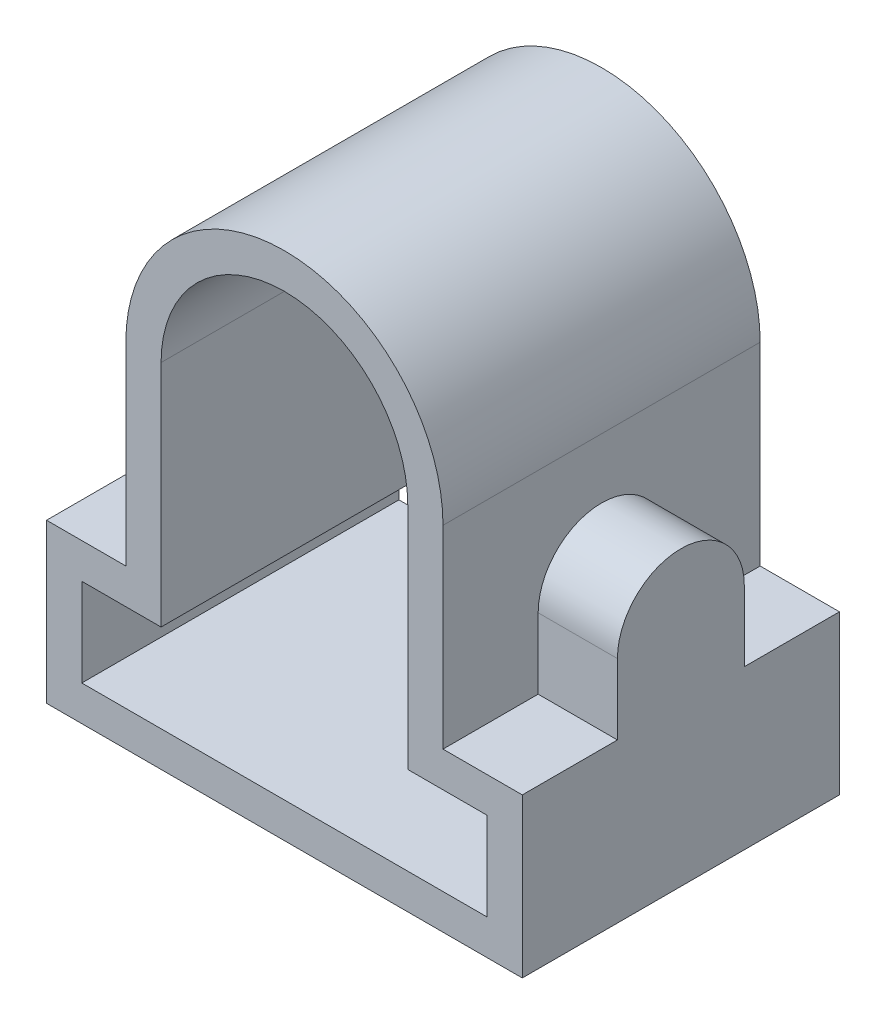
from build123d import *

# Parameters (mm, degrees)
BOSS_EXTRUDE1_DEPTH = 45
BOSS_EXTRUDE2_DEPTH = 22.5


with BuildPart() as part:
    # Sketch1 → Boss-Extrude1 (new, symmetric)
    with BuildSketch(Plane.XY):
        with BuildLine():
            Line((-67.5, 0), (67.5, 0))
            Line((67.5, 0), (67.5, 45))
            Line((67.5, 45), (45, 45))
            Line((45, 45), (45, 100))
            ThreePointArc((45, 100), (0, 145), (-45, 100))
            Line((-45, 100), (-45, 45))
            Line((-45, 45), (-67.5, 45))
            Line((-67.5, 45), (-67.5, 0))
        make_face()
        with BuildLine():
            Line((-35, 35), (-35, 100))
            ThreePointArc((-35, 100), (0, 135), (35, 100))
            Line((35, 100), (35, 35))
            Line((35, 35), (57.5, 35))
            Line((57.5, 35), (57.5, 10))
            Line((57.5, 10), (-57.5, 10))
            Line((-57.5, 10), (-57.5, 35))
            Line((-57.5, 35), (-35, 35))
        make_face(mode=Mode.SUBTRACT)
    extrude(amount=BOSS_EXTRUDE1_DEPTH, both=True)

    # Sketch2 → Boss-Extrude2 (add)
    with BuildSketch(Plane(origin=(45, 0, 0), x_dir=(0, 0, -1), z_dir=(1, 0, 0))):
        with BuildLine():
            Line((-18, 45), (-18, 65))
            ThreePointArc((-18, 65), (0, 83), (18, 65))
            Line((18, 65), (18, 45))
            Line((18, 45), (-18, 45))
        make_face()
    extrude(amount=BOSS_EXTRUDE2_DEPTH)


solid = part.part
